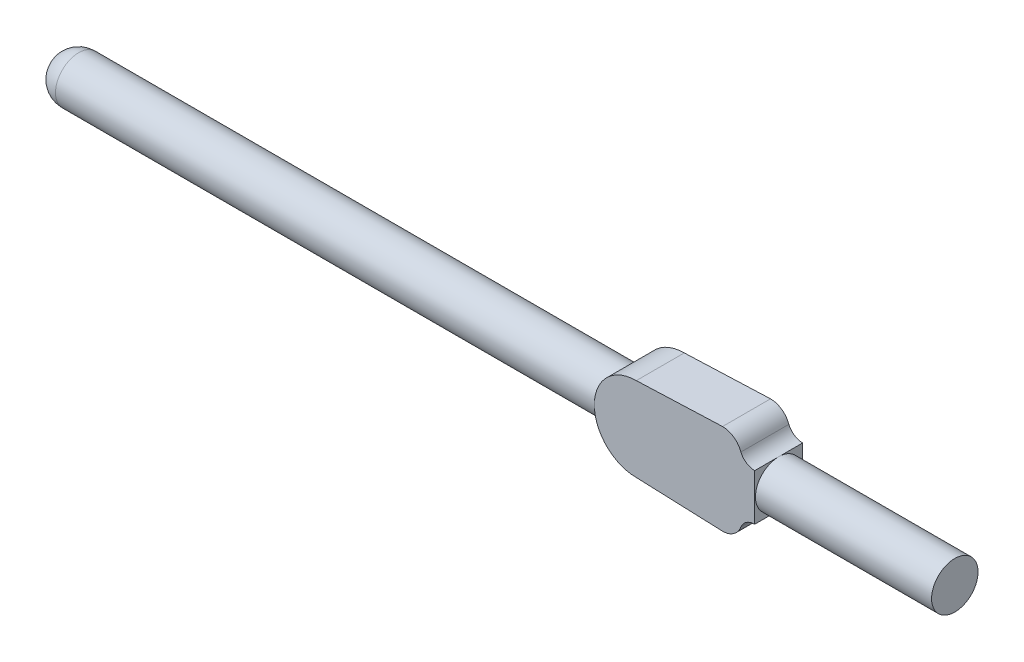
from build123d import *

# Parameters (mm, degrees)
SALIENTE_EXTRUIR1_DEPTH = 16


with BuildPart() as part:
    # Croquis1 → Revolución1 (revolve)
    with BuildSketch(Plane.XY):
        with BuildLine():
            Line((-300, 0), (300, 0))
            Line((300, 0), (300, 15.5))
            Line((300, 15.5), (-284.5, 15.5))
            ThreePointArc((-284.5, 15.5), (-295.460155108, 10.960155108), (-300, 0))
        make_face()
    revolve(axis=Axis((-657.792003839, 0, 0), (1, 0, 0)))

    # Croquis3 → Saliente-Extruir1 (add, symmetric)
    with BuildSketch(Plane.XY):
        with BuildLine():
            ThreePointArc((103.5, 28), (78.822074641, 13.228756555), (80.181552367, -15.5))
            Line((80.181552367, -15.5), (182.5, -15.5))
            Line((182.5, -15.5), (182.5, 15.5))
            ThreePointArc((182.5, 15.5), (176.96634932, 17.170611658), (173.281614908, 21.624257969))
            ThreePointArc((173.281614908, 21.624257969), (168.527455009, 27.876978724), (161.039643366, 30.25))
            Line((161.039643366, 30.25), (103.5, 28))
        make_face()
        with BuildLine():
            ThreePointArc((80.181552367, -15.5), (90.271243445, -24.677925359), (103.5, -28))
            Line((103.5, -28), (161.039643366, -30.25))
            ThreePointArc((161.039643366, -30.25), (168.527455009, -27.876978724), (173.281614908, -21.624257969))
            ThreePointArc((173.281614908, -21.624257969), (176.96634932, -17.170611658), (182.5, -15.5))
            Line((182.5, -15.5), (80.181552367, -15.5))
        make_face()
    extrude(amount=SALIENTE_EXTRUIR1_DEPTH, both=True)


solid = part.part
